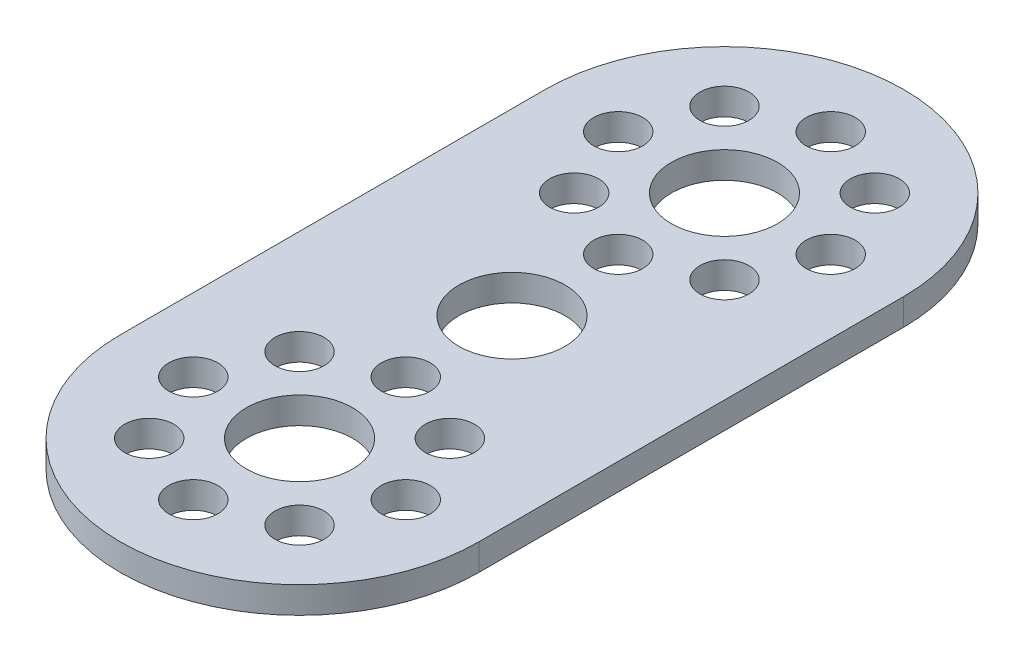
from build123d import *

# Parameters (mm, degrees)
EXTRUDE1_DEPTH = 2
SKETCH2_R      = 4
SKETCH2_R_2    = 1.85
EXTRUDE2_DEPTH = 2


with BuildPart() as part:
    # Sketch1 → Extrude1 (new body)
    with BuildSketch(Plane(origin=(0, 0, 0), x_dir=(1, 0, 0), z_dir=(0, 1, 0))):
        with BuildLine():
            Line((-13.5, 16), (-13.5, -16))
            ThreePointArc((-13.5, -16), (0, -29.5), (13.5, -16))
            Line((13.5, -16), (13.5, 16))
            ThreePointArc((13.5, 16), (0, 29.5), (-13.5, 16))
        make_face()
    extrude(amount=EXTRUDE1_DEPTH)

    # Sketch2 → Extrude2 (cut)
    with BuildSketch(Plane(origin=(0, 2, 0), x_dir=(1, 0, 0), z_dir=(0, 1, 0))):
        with Locations(Location((0, 0, 0), (0, 0, 270))):
            Circle(SKETCH2_R)
        with Locations(Location((8, -16, 0), (0, 0, 270))):
            Circle(SKETCH2_R_2)
        with Locations(Location((0, -24, 0), (0, 0, 270))):
            Circle(SKETCH2_R_2)
        with Locations(Location((0, -16, 0), (0, 0, 270))):
            Circle(SKETCH2_R)
        with Locations(Location((0, -8, 0), (0, 0, 270))):
            Circle(SKETCH2_R_2)
        with Locations(Location((-5.66, -10.34, 0), (0, 0, 270))):
            Circle(SKETCH2_R_2)
        with Locations(Location((-5.66, -21.66, 0), (0, 0, 270))):
            Circle(SKETCH2_R_2)
        with Locations(Location((-8, -16, 0), (0, 0, 270))):
            Circle(SKETCH2_R_2)
        with Locations(Location((5.66, -10.34, 0), (0, 0, 270))):
            Circle(SKETCH2_R_2)
        with Locations(Location((5.66, -21.66, 0), (0, 0, 270))):
            Circle(SKETCH2_R_2)
        with Locations(Location((8, 16, 0), (0, 0, 270))):
            Circle(SKETCH2_R_2)
        with Locations(Location((0, 8, 0), (0, 0, 270))):
            Circle(SKETCH2_R_2)
        with Locations(Location((0, 16, 0), (0, 0, 270))):
            Circle(SKETCH2_R)
        with Locations(Location((0, 24, 0), (0, 0, 270))):
            Circle(SKETCH2_R_2)
        with Locations(Location((-5.66, 21.66, 0), (0, 0, 270))):
            Circle(SKETCH2_R_2)
        with Locations(Location((-5.66, 10.34, 0), (0, 0, 270))):
            Circle(SKETCH2_R_2)
        with Locations(Location((-8, 16, 0), (0, 0, 270))):
            Circle(SKETCH2_R_2)
        with Locations(Location((5.66, 21.66, 0), (0, 0, 270))):
            Circle(SKETCH2_R_2)
        with Locations(Location((5.66, 10.34, 0), (0, 0, 270))):
            Circle(SKETCH2_R_2)
    extrude(amount=-EXTRUDE2_DEPTH, mode=Mode.SUBTRACT)


solid = part.part
